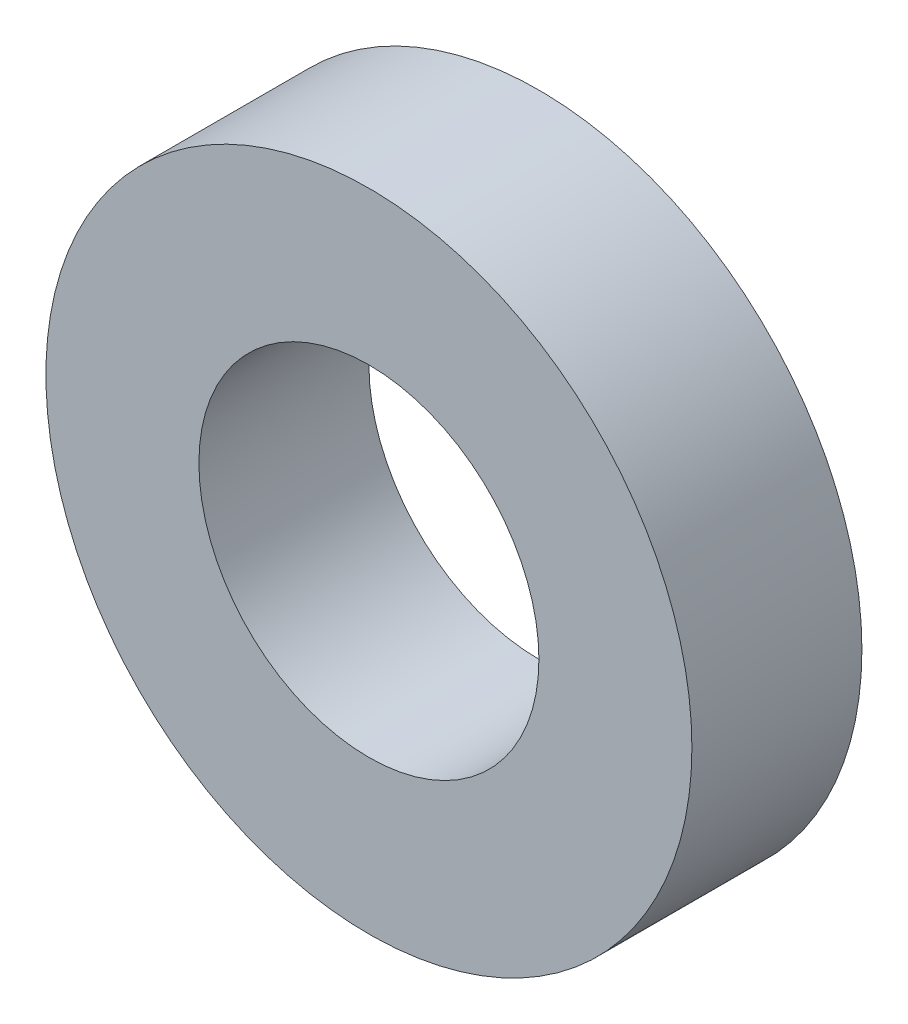
from build123d import *

# Parameters (mm, degrees)
SKETCH1_R           = 9.5
SKETCH1_R_2         = 5
BOSS_EXTRUDE1_DEPTH = 5


with BuildPart() as part:
    # Sketch1 → Boss-Extrude1 (new body)
    with BuildSketch(Plane.XY):
        Circle(SKETCH1_R)
        Circle(SKETCH1_R_2, mode=Mode.SUBTRACT)
    extrude(amount=BOSS_EXTRUDE1_DEPTH)


solid = part.part
